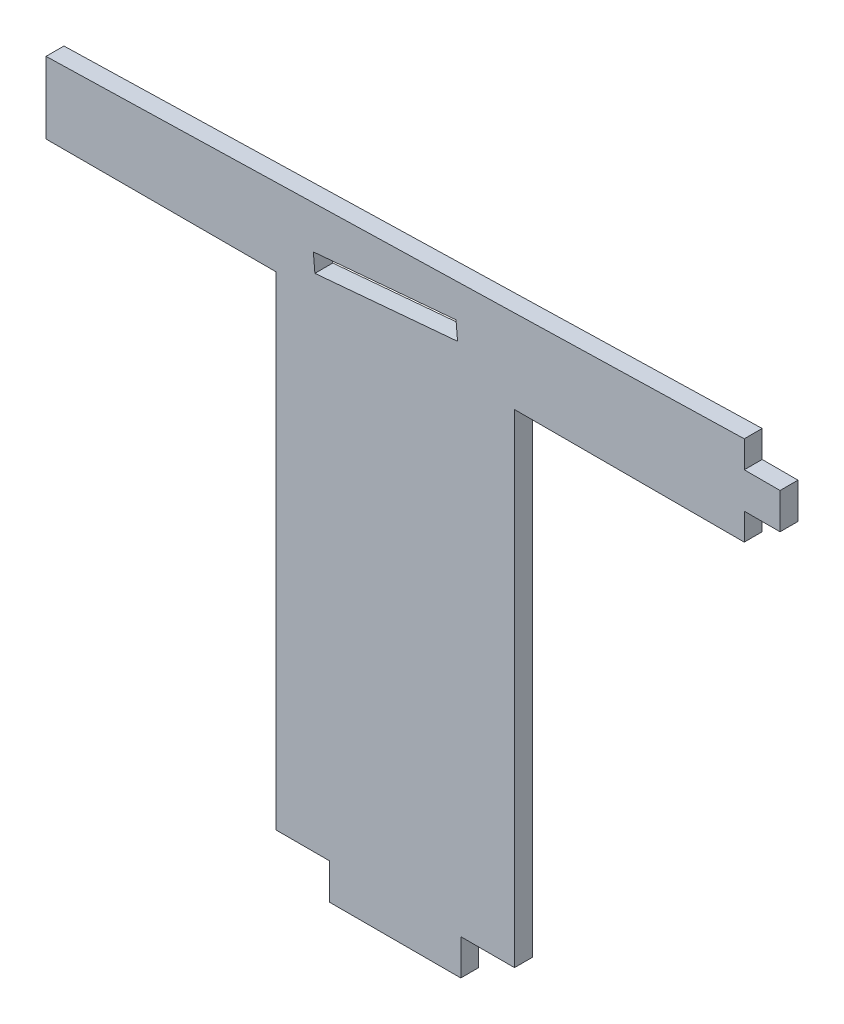
from build123d import *

# Parameters (mm, degrees)
BOSS_EXTRUDE1_DEPTH = 3
CUT_EXTRUDE1_DEPTH  = 125.045354609
SKETCH3_W           = 6
SKETCH3_H           = 6
SKETCH3_W_2         = 22
BOSS_EXTRUDE2_DEPTH = 3


with BuildPart() as part:
    # Sketch1 → Boss-Extrude1 (new body)
    with BuildSketch(Plane.XY):
        Polygon((-78.5, 93), (-78.5, 81), (-40, 81), (-40, 0), (0, 0), (0, 81), (38.5, 81), (38.5, 96), align=None)
    extrude(amount=BOSS_EXTRUDE1_DEPTH)

    # Sketch2 → Cut-Extrude1 (cut, through all)
    with BuildSketch(Plane.XY.offset(3)):
        Polygon((-33.71, 87.02), (-33.448532772, 84.031415906), (-9.539860018, 86.123153732), (-9.801327246, 89.111737826), align=None)
    extrude(amount=-CUT_EXTRUDE1_DEPTH, mode=Mode.SUBTRACT)

    # Sketch3 → Boss-Extrude2 (add, through all)
    with BuildSketch(Plane.XY.offset(3)):
        with Locations((41.5, 88.5)):
            Rectangle(SKETCH3_W, SKETCH3_H)
        with Locations((-20, -3)):
            Rectangle(SKETCH3_W_2, SKETCH3_H)
    extrude(amount=-BOSS_EXTRUDE2_DEPTH)


solid = part.part
